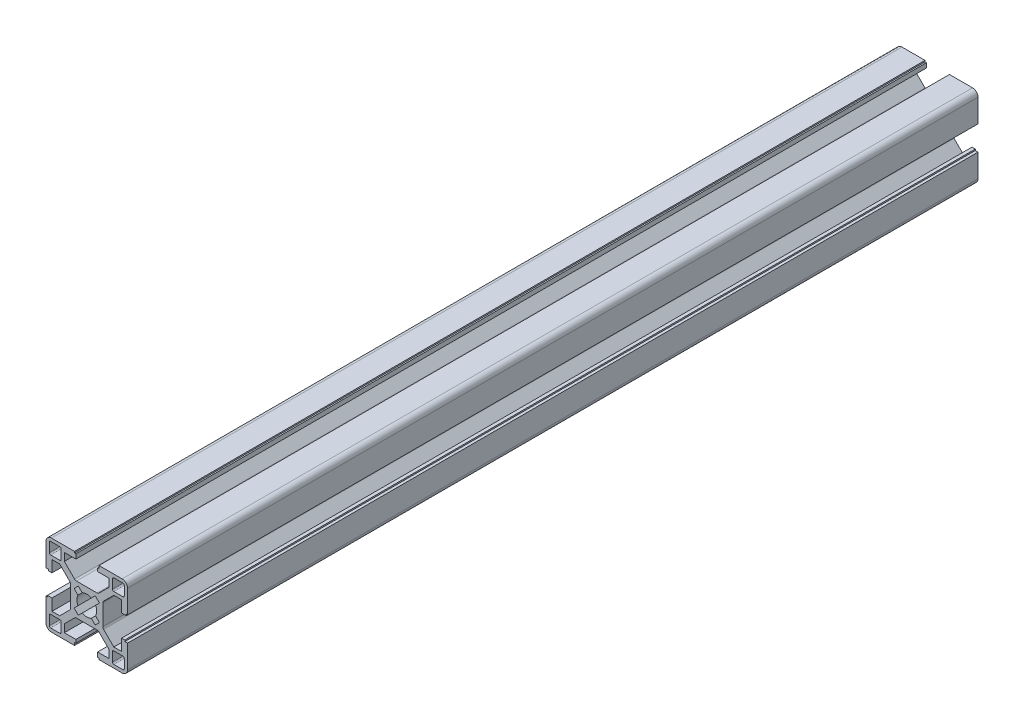
from build123d import *

# Parameters (mm, degrees)
BOSS_EXTRUDE1_DEPTH = 313


with BuildPart() as part:
    # Sketch1 → Boss-Extrude1 (new body)
    with BuildSketch(Plane.XY):
        with BuildLine():
            Line((-4.5, 14.5), (-4.5, 15))
            Line((-4.5, 15), (-13, 15))
            ThreePointArc((-13, 15), (-14.414213562, 14.414213562), (-15, 13))
            Line((-15, 13), (-15, 4.5))
            Line((-15, 4.5), (-14, 4.5))
            Line((-14, 4.5), (-14, 4))
            Line((-14, 4), (-12.8, 4))
            Line((-12.8, 4), (-12.8, 8.25))
            Line((-12.8, 8.25), (-9.95, 8.25))
            Line((-9.95, 8.25), (-6.192893219, 4.492893219))
            ThreePointArc((-6.192893219, 4.492893219), (-5.976120467, 4.16846987), (-5.9, 3.785786438))
            Line((-5.9, 3.785786438), (-5.9, -3.785786438))
            ThreePointArc((-5.9, -3.785786438), (-5.976120467, -4.16846987), (-6.192893219, -4.492893219))
            Line((-6.192893219, -4.492893219), (-9.95, -8.25))
            Line((-9.95, -8.25), (-12.8, -8.25))
            Line((-12.8, -8.25), (-12.8, -4))
            Line((-12.8, -4), (-14.5, -4))
            Line((-14.5, -4), (-14.5, -4.5))
            Line((-14.5, -4.5), (-15, -4.5))
            Line((-15, -4.5), (-15, -13))
            ThreePointArc((-15, -13), (-14.414213562, -14.414213562), (-13, -15))
            Line((-13, -15), (-4.5, -15))
            Line((-4.5, -15), (-4.5, -14))
            Line((-4.5, -14), (-4, -14))
            Line((-4, -14), (-4, -12.8))
            Line((-4, -12.8), (-8.25, -12.8))
            Line((-8.25, -12.8), (-8.25, -9.95))
            Line((-8.25, -9.95), (-4.492893219, -6.192893219))
            ThreePointArc((-4.492893219, -6.192893219), (-4.16846987, -5.976120467), (-3.785786438, -5.9))
            Line((-3.785786438, -5.9), (3.785786438, -5.9))
            ThreePointArc((3.785786438, -5.9), (4.16846987, -5.976120467), (4.492893219, -6.192893219))
            Line((4.492893219, -6.192893219), (8.25, -9.95))
            Line((8.25, -9.95), (8.25, -12.8))
            Line((8.25, -12.8), (4, -12.8))
            Line((4, -12.8), (4, -14.5))
            Line((4, -14.5), (4.5, -14.5))
            Line((4.5, -14.5), (4.5, -15))
            Line((4.5, -15), (13, -15))
            ThreePointArc((13, -15), (14.414213562, -14.414213562), (15, -13))
            Line((15, -13), (15, -4.5))
            Line((15, -4.5), (14, -4.5))
            Line((14, -4.5), (14, -4))
            Line((14, -4), (12.8, -4))
            Line((12.8, -4), (12.8, -8.25))
            Line((12.8, -8.25), (9.95, -8.25))
            Line((9.95, -8.25), (6.192893219, -4.492893219))
            ThreePointArc((6.192893219, -4.492893219), (5.976120467, -4.16846987), (5.9, -3.785786438))
            Line((5.9, -3.785786438), (5.9, 3.785786438))
            ThreePointArc((5.9, 3.785786438), (5.976120467, 4.16846987), (6.192893219, 4.492893219))
            Line((6.192893219, 4.492893219), (9.95, 8.25))
            Line((9.95, 8.25), (12.8, 8.25))
            Line((12.8, 8.25), (12.8, 4))
            Line((12.8, 4), (14.5, 4))
            Line((14.5, 4), (14.5, 4.5))
            Line((14.5, 4.5), (15, 4.5))
            Line((15, 4.5), (15, 13))
            ThreePointArc((15, 13), (14.414213562, 14.414213562), (13, 15))
            Line((13, 15), (4.5, 15))
            Line((4.5, 15), (4.5, 14))
            Line((4.5, 14), (4, 14))
            Line((4, 14), (4, 12.8))
            Line((4, 12.8), (8.25, 12.8))
            Line((8.25, 12.8), (8.25, 9.95))
            Line((8.25, 9.95), (4.492893219, 6.192893219))
            ThreePointArc((4.492893219, 6.192893219), (4.16846987, 5.976120467), (3.785786438, 5.9))
            Line((3.785786438, 5.9), (-3.785786438, 5.9))
            ThreePointArc((-3.785786438, 5.9), (-4.16846987, 5.976120467), (-4.492893219, 6.192893219))
            Line((-4.492893219, 6.192893219), (-8.25, 9.95))
            Line((-8.25, 9.95), (-8.25, 12.8))
            Line((-8.25, 12.8), (-4, 12.8))
            Line((-4, 12.8), (-4, 14.5))
            Line((-4, 14.5), (-4.5, 14.5))
        make_face()
        with BuildLine():
            Line((-9.45, -9.95), (-9.45, -13.3))
            ThreePointArc((-9.45, -13.3), (-9.596446609, -13.653553391), (-9.95, -13.8))
            Line((-9.95, -13.8), (-13.3, -13.8))
            ThreePointArc((-13.3, -13.8), (-13.653553391, -13.653553391), (-13.8, -13.3))
            Line((-13.8, -13.3), (-13.8, -9.95))
            ThreePointArc((-13.8, -9.95), (-13.653553391, -9.596446609), (-13.3, -9.45))
            Line((-13.3, -9.45), (-9.95, -9.45))
            ThreePointArc((-9.95, -9.45), (-9.596446609, -9.596446609), (-9.45, -9.95))
        make_face(mode=Mode.SUBTRACT)
        with BuildLine():
            Line((9.95, -9.45), (13.3, -9.45))
            ThreePointArc((13.3, -9.45), (13.653553391, -9.596446609), (13.8, -9.95))
            Line((13.8, -9.95), (13.8, -13.3))
            ThreePointArc((13.8, -13.3), (13.653553391, -13.653553391), (13.3, -13.8))
            Line((13.3, -13.8), (9.95, -13.8))
            ThreePointArc((9.95, -13.8), (9.596446609, -13.653553391), (9.45, -13.3))
            Line((9.45, -13.3), (9.45, -9.95))
            ThreePointArc((9.45, -9.95), (9.596446609, -9.596446609), (9.95, -9.45))
        make_face(mode=Mode.SUBTRACT)
        with BuildLine():
            Line((-9.95, 9.45), (-13.3, 9.45))
            ThreePointArc((-13.3, 9.45), (-13.653553391, 9.596446609), (-13.8, 9.95))
            Line((-13.8, 9.95), (-13.8, 13.3))
            ThreePointArc((-13.8, 13.3), (-13.653553391, 13.653553391), (-13.3, 13.8))
            Line((-13.3, 13.8), (-9.95, 13.8))
            ThreePointArc((-9.95, 13.8), (-9.596446609, 13.653553391), (-9.45, 13.3))
            Line((-9.45, 13.3), (-9.45, 9.95))
            ThreePointArc((-9.45, 9.95), (-9.596446609, 9.596446609), (-9.95, 9.45))
        make_face(mode=Mode.SUBTRACT)
        with BuildLine():
            ThreePointArc((1.683127481, -3.2387624), (0, -3.65), (-1.683127481, -3.2387624))
            Line((-1.683127481, -3.2387624), (-3.111269837, -4.666904756))
            Line((-3.111269837, -4.666904756), (-4.666904756, -3.111269837))
            Line((-4.666904756, -3.111269837), (-3.2387624, -1.683127481))
            ThreePointArc((-3.2387624, -1.683127481), (-3.65, 0), (-3.2387624, 1.683127481))
            Line((-3.2387624, 1.683127481), (-4.666904756, 3.111269837))
            Line((-4.666904756, 3.111269837), (-3.111269837, 4.666904756))
            Line((-3.111269837, 4.666904756), (-1.683127481, 3.2387624))
            ThreePointArc((-1.683127481, 3.2387624), (0, 3.65), (1.683127481, 3.2387624))
            Line((1.683127481, 3.2387624), (3.111269837, 4.666904756))
            Line((3.111269837, 4.666904756), (4.666904756, 3.111269837))
            Line((4.666904756, 3.111269837), (3.2387624, 1.683127481))
            ThreePointArc((3.2387624, 1.683127481), (3.65, 0), (3.2387624, -1.683127481))
            Line((3.2387624, -1.683127481), (4.666904756, -3.111269837))
            Line((4.666904756, -3.111269837), (3.111269837, -4.666904756))
            Line((3.111269837, -4.666904756), (1.683127481, -3.2387624))
        make_face(mode=Mode.SUBTRACT)
        with BuildLine():
            ThreePointArc((9.45, 13.3), (9.596446609, 13.653553391), (9.95, 13.8))
            Line((9.95, 13.8), (13.3, 13.8))
            ThreePointArc((13.3, 13.8), (13.653553391, 13.653553391), (13.8, 13.3))
            Line((13.8, 13.3), (13.8, 9.95))
            ThreePointArc((13.8, 9.95), (13.653553391, 9.596446609), (13.3, 9.45))
            Line((13.3, 9.45), (9.95, 9.45))
            ThreePointArc((9.95, 9.45), (9.596446609, 9.596446609), (9.45, 9.95))
            Line((9.45, 9.95), (9.45, 13.3))
        make_face(mode=Mode.SUBTRACT)
    extrude(amount=BOSS_EXTRUDE1_DEPTH)


solid = part.part
